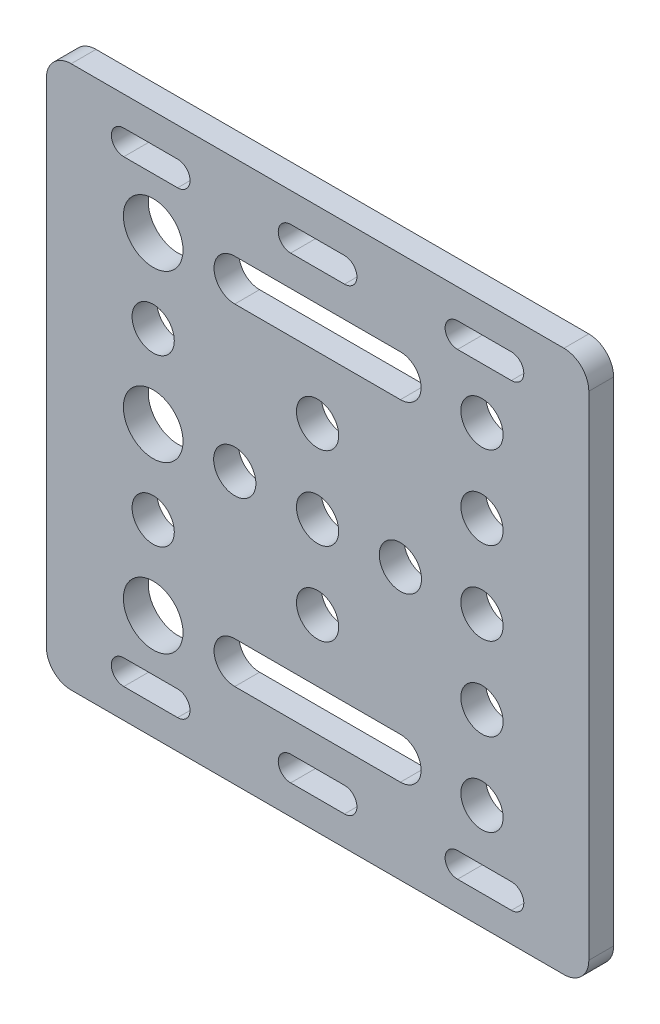
from build123d import *

# Parameters (mm, degrees)
SKETCH_1_R      = 2.55
SKETCH_1_R_2    = 3.6
EXTRUDE_1_DEPTH = 3


with BuildPart() as part:
    # Эскиз1 → Бобышка-Вытянуть1 (new body)
    with BuildSketch(Plane.XY):
        with BuildLine():
            Line((3, 0), (62.5, 0))
            ThreePointArc((62.5, 0), (64.621320344, -0.878679656), (65.5, -3))
            Line((65.5, -3), (65.5, -62.5))
            ThreePointArc((65.5, -62.5), (64.621320344, -64.621320344), (62.5, -65.5))
            Line((62.5, -65.5), (3, -65.5))
            ThreePointArc((3, -65.5), (0.878679656, -64.621320344), (0, -62.5))
            Line((0, -62.5), (0, -3))
            ThreePointArc((0, -3), (0.878679656, -0.878679656), (3, 0))
        make_face()
        with Locations((52.6, -12.75)):
            Circle(SKETCH_1_R, mode=Mode.SUBTRACT)
        with Locations((52.6, -22.75)):
            Circle(SKETCH_1_R, mode=Mode.SUBTRACT)
        with Locations((52.6, -32.75)):
            Circle(SKETCH_1_R, mode=Mode.SUBTRACT)
        with Locations((52.6, -42.75)):
            Circle(SKETCH_1_R, mode=Mode.SUBTRACT)
        with Locations((52.6, -52.75)):
            Circle(SKETCH_1_R, mode=Mode.SUBTRACT)
        with Locations((12.9, -12.75)):
            Circle(SKETCH_1_R_2, mode=Mode.SUBTRACT)
        with Locations((12.9, -22.75)):
            Circle(SKETCH_1_R, mode=Mode.SUBTRACT)
        with Locations((12.9, -32.75)):
            Circle(SKETCH_1_R_2, mode=Mode.SUBTRACT)
        with Locations((12.9, -42.75)):
            Circle(SKETCH_1_R, mode=Mode.SUBTRACT)
        with Locations((12.9, -52.75)):
            Circle(SKETCH_1_R_2, mode=Mode.SUBTRACT)
        with Locations((22.75, -32.75)):
            Circle(SKETCH_1_R, mode=Mode.SUBTRACT)
        with Locations((32.75, -32.75)):
            Circle(SKETCH_1_R, mode=Mode.SUBTRACT)
        with Locations((42.75, -32.75)):
            Circle(SKETCH_1_R, mode=Mode.SUBTRACT)
        with Locations((32.75, -22.75)):
            Circle(SKETCH_1_R, mode=Mode.SUBTRACT)
        with Locations((32.75, -42.75)):
            Circle(SKETCH_1_R, mode=Mode.SUBTRACT)
        with BuildLine():
            Line((9.35, -3.55), (15.85, -3.55))
            ThreePointArc((15.85, -3.55), (17.35, -5.05), (15.85, -6.55))
            Line((15.85, -6.55), (9.35, -6.55))
            ThreePointArc((9.35, -6.55), (7.85, -5.05), (9.35, -3.55))
        make_face(mode=Mode.SUBTRACT)
        with BuildLine():
            Line((29.5, -3.55), (36, -3.55))
            ThreePointArc((36, -3.55), (37.5, -5.05), (36, -6.55))
            Line((36, -6.55), (29.5, -6.55))
            ThreePointArc((29.5, -6.55), (28, -5.05), (29.5, -3.55))
        make_face(mode=Mode.SUBTRACT)
        with BuildLine():
            Line((49.65, -3.55), (56.15, -3.55))
            ThreePointArc((56.15, -3.55), (57.65, -5.05), (56.15, -6.55))
            Line((56.15, -6.55), (49.65, -6.55))
            ThreePointArc((49.65, -6.55), (48.15, -5.05), (49.65, -3.55))
        make_face(mode=Mode.SUBTRACT)
        with BuildLine():
            Line((9.35, -58.95), (15.85, -58.95))
            ThreePointArc((15.85, -58.95), (17.35, -60.45), (15.85, -61.95))
            Line((15.85, -61.95), (9.35, -61.95))
            ThreePointArc((9.35, -61.95), (7.85, -60.45), (9.35, -58.95))
        make_face(mode=Mode.SUBTRACT)
        with BuildLine():
            Line((29.5, -58.95), (36, -58.95))
            ThreePointArc((36, -58.95), (37.5, -60.45), (36, -61.95))
            Line((36, -61.95), (29.5, -61.95))
            ThreePointArc((29.5, -61.95), (28, -60.45), (29.5, -58.95))
        make_face(mode=Mode.SUBTRACT)
        with BuildLine():
            Line((49.65, -58.95), (56.15, -58.95))
            ThreePointArc((56.15, -58.95), (57.65, -60.45), (56.15, -61.95))
            Line((56.15, -61.95), (49.65, -61.95))
            ThreePointArc((49.65, -61.95), (48.15, -60.45), (49.65, -58.95))
        make_face(mode=Mode.SUBTRACT)
        with BuildLine():
            Line((22.75, -50.25), (42.75, -50.25))
            ThreePointArc((42.75, -50.25), (45.25, -52.75), (42.75, -55.25))
            Line((42.75, -55.25), (22.75, -55.25))
            ThreePointArc((22.75, -55.25), (20.25, -52.75), (22.75, -50.25))
        make_face(mode=Mode.SUBTRACT)
        with BuildLine():
            Line((22.75, -10.25), (42.75, -10.25))
            ThreePointArc((42.75, -10.25), (45.25, -12.75), (42.75, -15.25))
            Line((42.75, -15.25), (22.75, -15.25))
            ThreePointArc((22.75, -15.25), (20.25, -12.75), (22.75, -10.25))
        make_face(mode=Mode.SUBTRACT)
    extrude(amount=EXTRUDE_1_DEPTH)


solid = part.part
